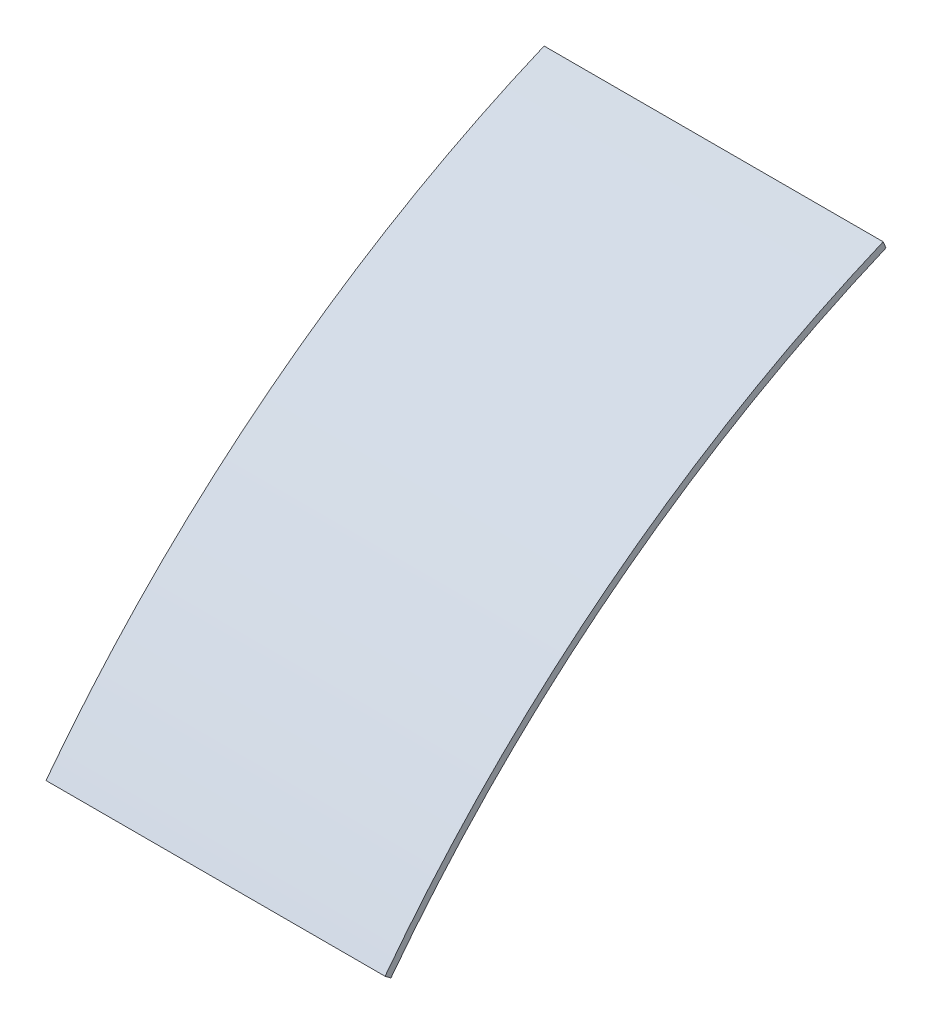
from build123d import *

# Parameters (mm, degrees)
BOSS_EXTRUDE1_DEPTH = 146.2024


with BuildPart() as part:
    # Sketch1 → Boss-Extrude1 (new body)
    with BuildSketch(Plane(origin=(0, 0, 0), x_dir=(0, 0, -1), z_dir=(1, 0, 0))):
        with BuildLine():
            Line((-213.527987278, -167.865893887), (-212.262670256, -168.824606088))
            ThreePointArc((-212.262670256, -168.824606088), (-116.43523539, -71.82151681), (1.233217804, -2.925713414))
            Line((1.233217804, -2.925713414), (0.616608902, -1.462856707))
            ThreePointArc((0.616608902, -1.462856707), (-117.409376916, -70.568039828), (-213.527987278, -167.865893887))
        make_face()
        with BuildLine():
            Line((-214.793304301, -166.907181687), (-213.527987278, -167.865893887))
            ThreePointArc((-213.527987278, -167.865893887), (-117.409376916, -70.568039828), (0.616608902, -1.462856707))
            Line((0.616608902, -1.462856707), (0, 0))
            ThreePointArc((0, 0), (-118.383518443, -69.314562846), (-214.793304301, -166.907181687))
        make_face()
    extrude(amount=BOSS_EXTRUDE1_DEPTH)


solid = part.part
